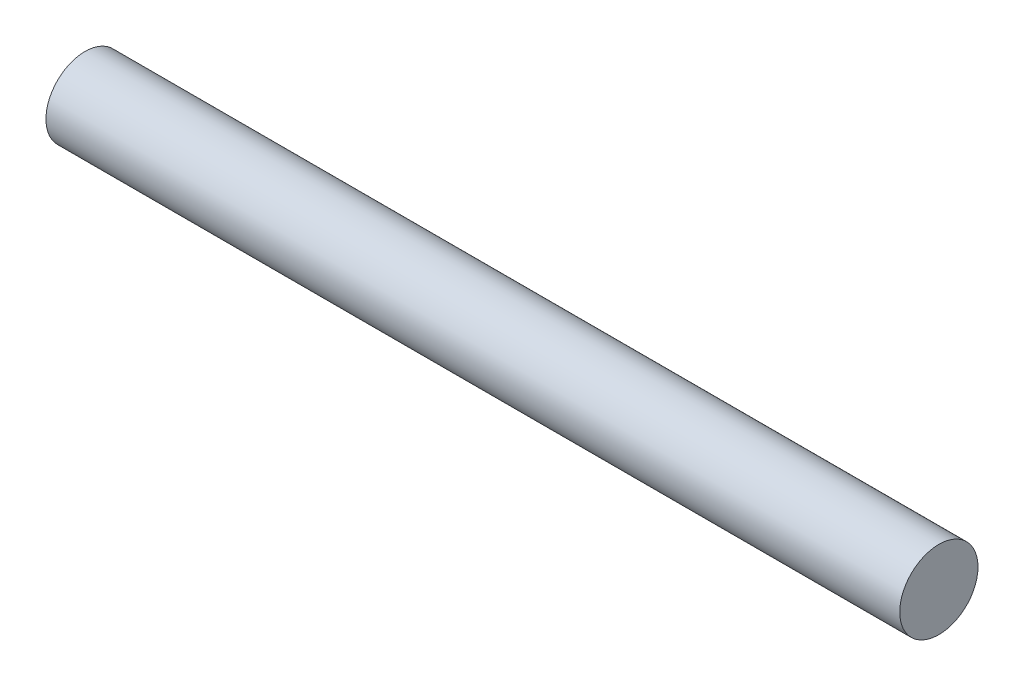
from build123d import *

# Parameters (mm, degrees)
SKETCH1_R           = 1
BOSS_EXTRUDE1_DEPTH = 10.90936839


with BuildPart() as part:
    # Sketch1 → Boss-Extrude1 (new, symmetric)
    with BuildSketch(Plane(origin=(0, 0, 0), x_dir=(0, 0, -1), z_dir=(1, 0, 0))):
        Circle(SKETCH1_R)
    extrude(amount=BOSS_EXTRUDE1_DEPTH, both=True)


solid = part.part
